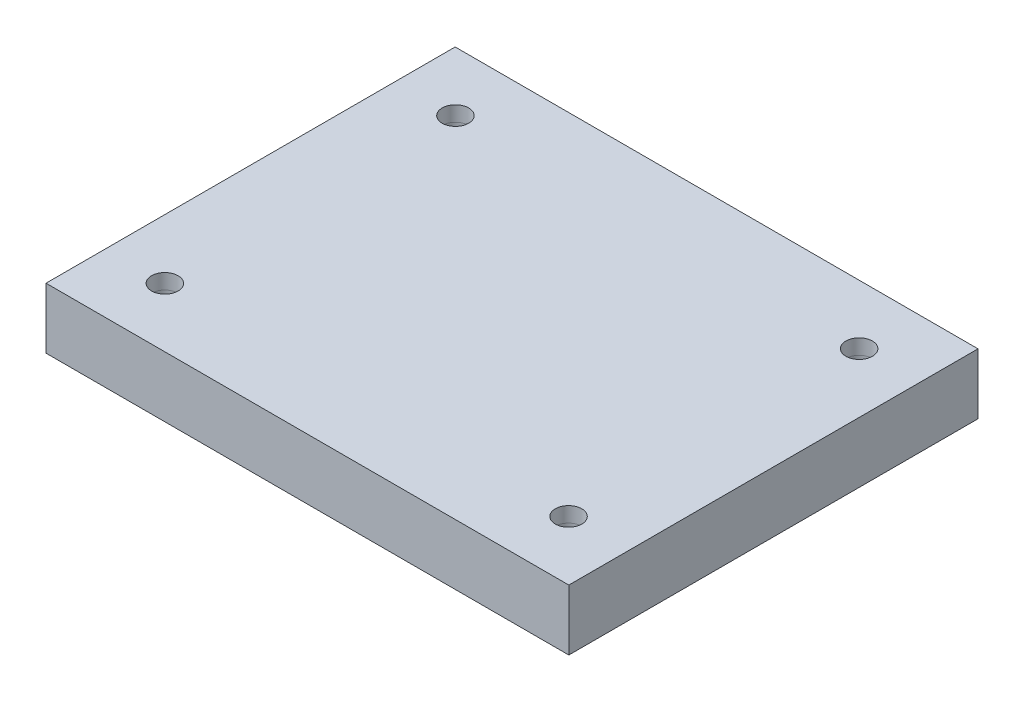
from build123d import *

# Parameters (mm, degrees)
SKETCH1_W             = 69
SKETCH1_H             = 54
SKETCH1_W_2           = 61
SKETCH1_H_2           = 46
BOSS_EXTRUDE1_DEPTH   = 6
SKETCH2_W             = 69
SKETCH2_H             = 54
SKETCH2_R             = 1.75
BOSS_EXTRUDE2_DEPTH   = 2
SKETCH3_R             = 3.9
SKETCH3_R_2           = 1.75
BOSS_EXTRUDE5_DEPTH   = 6
BOSS_EXTRUDE5_2_DEPTH = 6
BOSS_EXTRUDE5_3_DEPTH = 6
BOSS_EXTRUDE5_4_DEPTH = 6


with BuildPart() as part:
    # Sketch1 → Boss-Extrude1 (new body)
    with BuildSketch(Plane(origin=(0, 0, 0), x_dir=(1, 0, 0), z_dir=(0, 1, 0))):
        Rectangle(SKETCH1_W, SKETCH1_H)
        Rectangle(SKETCH1_W_2, SKETCH1_H_2, mode=Mode.SUBTRACT)
    extrude(amount=BOSS_EXTRUDE1_DEPTH)

    # Sketch2 → Boss-Extrude2 (add)
    with BuildSketch(Plane(origin=(0, 6, 0), x_dir=(1, 0, 0), z_dir=(0, 1, 0))):
        Rectangle(SKETCH2_W, SKETCH2_H)
        with Locations(Location((-26.638347595, 19.175016295, 0), (0, 0, 270))):
            Circle(SKETCH2_R, mode=Mode.SUBTRACT)
        with Locations(Location((26.638347595, 19.175016295, 0), (0, 0, 90))):
            Circle(SKETCH2_R, mode=Mode.SUBTRACT)
        with Locations(Location((26.638347595, -19.175016295, 0), (0, 0, 270))):
            Circle(SKETCH2_R, mode=Mode.SUBTRACT)
        with Locations(Location((-26.638347595, -19.175016295, 0), (0, 0, 90))):
            Circle(SKETCH2_R, mode=Mode.SUBTRACT)
    extrude(amount=BOSS_EXTRUDE2_DEPTH)


with BuildPart() as body_2:
    # Sketch3 → Boss-Extrude5 (new body)
    with BuildSketch(Plane.XZ.offset(-6)):
        with Locations(Location((-26.638347595, 19.175016295, 0), (0, 0, 270))):
            Circle(SKETCH3_R)
        with Locations(Location((-26.638347595, 19.175016295, 0), (0, 0, 270))):
            Circle(SKETCH3_R_2, mode=Mode.SUBTRACT)
    extrude(amount=BOSS_EXTRUDE5_DEPTH)


with BuildPart() as body_3:
    # Sketch3 → Boss-Extrude5 2 (new body)
    with BuildSketch(Plane.XZ.offset(-6)):
        with Locations(Location((-26.638347595, -19.175016295, 0), (0, 0, 270))):
            Circle(SKETCH3_R)
        with Locations(Location((-26.638347595, -19.175016295, 0), (0, 0, 270))):
            Circle(SKETCH3_R_2, mode=Mode.SUBTRACT)
    extrude(amount=BOSS_EXTRUDE5_2_DEPTH)


with BuildPart() as body_4:
    # Sketch3 → Boss-Extrude5 3 (new body)
    with BuildSketch(Plane.XZ.offset(-6)):
        with Locations(Location((26.638347595, -19.175016295, 0), (0, 0, 270))):
            Circle(SKETCH3_R)
        with Locations(Location((26.638347595, -19.175016295, 0), (0, 0, 270))):
            Circle(SKETCH3_R_2, mode=Mode.SUBTRACT)
    extrude(amount=BOSS_EXTRUDE5_3_DEPTH)


with BuildPart() as body_5:
    # Sketch3 → Boss-Extrude5 4 (new body)
    with BuildSketch(Plane.XZ.offset(-6)):
        with Locations(Location((26.638347595, 19.175016295, 0), (0, 0, 270))):
            Circle(SKETCH3_R)
        with Locations(Location((26.638347595, 19.175016295, 0), (0, 0, 270))):
            Circle(SKETCH3_R_2, mode=Mode.SUBTRACT)
    extrude(amount=BOSS_EXTRUDE5_4_DEPTH)


solid = Compound([part.part, body_2.part, body_3.part, body_4.part, body_5.part])
